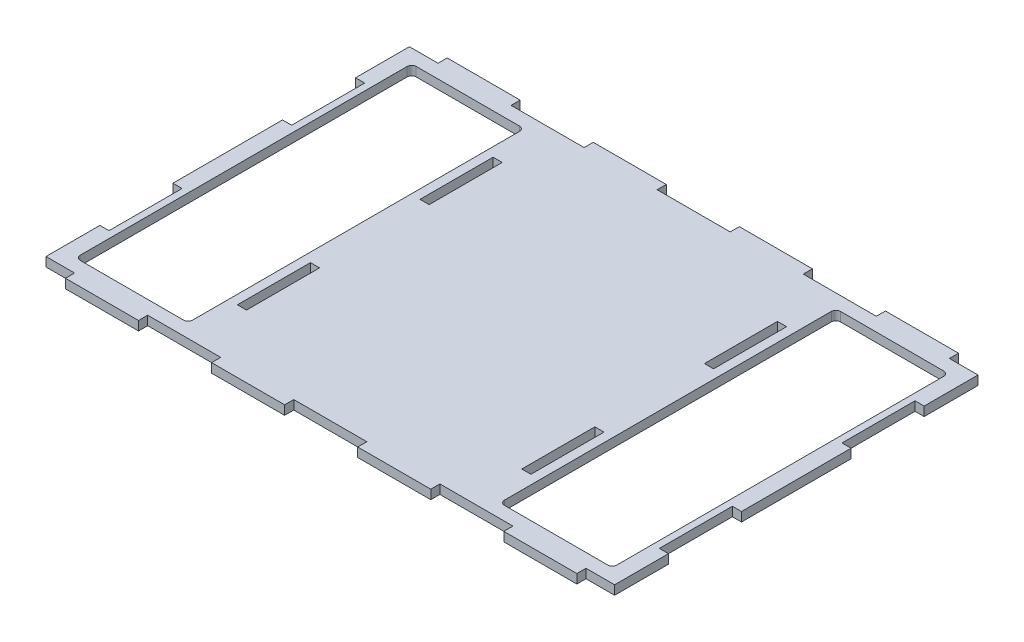
from build123d import *

# Parameters (mm, degrees)
SKETCH5_W           = 395.4
SKETCH5_H           = 265.4
BOSS_EXTRUDE3_DEPTH = 6.35
SKETCH6_W           = 78.175
SKETCH6_H           = 243.175
SKETCH6_W_2         = 75
SKETCH6_H_2         = 240
CUT_EXTRUDE1_DEPTH  = 6.35
SKETCH10_W          = 6.35
SKETCH10_H          = 50.8
SKETCH10_W_2        = 50.8
SKETCH10_H_2        = 6.35
CUT_EXTRUDE2_DEPTH  = 6.35
SKETCH11_W          = 50.8
SKETCH11_H          = 6.35
CUT_EXTRUDE3_DEPTH  = 6.35
SKETCH12_W          = 78.175
SKETCH12_H          = 4.7625
BOSS_EXTRUDE4_DEPTH = 6.35
FILLET1_R           = 3.175


with BuildPart() as part:
    # Sketch5 → Boss-Extrude3 (new body)
    with BuildSketch(Plane(origin=(0, 0, 0), x_dir=(1, 0, 0), z_dir=(0, 1, 0))):
        Rectangle(SKETCH5_W, SKETCH5_H)
    extrude(amount=BOSS_EXTRUDE3_DEPTH)

    # Sketch6 → Cut-Extrude1 (cut)
    # profile 1 of 4: a face of its own
    with BuildSketch(Plane(origin=(0, 6.35, 0), x_dir=(1, 0, 0), z_dir=(0, 1, 0))):
        with Locations((147.5, 0)):
            Rectangle(SKETCH6_W, SKETCH6_H)
        with Locations((147.5, 0)):
            Rectangle(SKETCH6_W_2, SKETCH6_H_2, mode=Mode.SUBTRACT)
    # profile 2 of 4: a face of its own
    with BuildSketch(Plane(origin=(0, 6.35, 0), x_dir=(1, 0, 0), z_dir=(0, 1, 0))):
        with Locations((147.5, 0)):
            Rectangle(SKETCH6_W_2, SKETCH6_H_2)
    # profile 3 of 4: a face of its own
    with BuildSketch(Plane(origin=(0, 6.35, 0), x_dir=(1, 0, 0), z_dir=(0, 1, 0))):
        with Locations((-147.5, 0)):
            Rectangle(SKETCH6_W, SKETCH6_H)
        with Locations((-147.5, 0)):
            Rectangle(SKETCH6_W_2, SKETCH6_H_2, mode=Mode.SUBTRACT)
    # profile 4 of 4: a face of its own
    with BuildSketch(Plane(origin=(0, 6.35, 0), x_dir=(1, 0, 0), z_dir=(0, 1, 0))):
        with Locations((-147.5, 0)):
            Rectangle(SKETCH6_W_2, SKETCH6_H_2)
    extrude(amount=-CUT_EXTRUDE1_DEPTH, mode=Mode.SUBTRACT)

    # Sketch10 → Cut-Extrude2 (cut)
    with BuildSketch(Plane.XZ):
        with Locations((98.8875, -63.5)):
            Rectangle(SKETCH10_W, SKETCH10_H)
        with Locations((98.8875, 63.5)):
            Rectangle(SKETCH10_W, SKETCH10_H)
        with Locations((-98.8875, 63.5)):
            Rectangle(SKETCH10_W, SKETCH10_H)
        with Locations((-98.8875, -63.5)):
            Rectangle(SKETCH10_W, SKETCH10_H)
        Polygon((197.7, 132.7), (177.8, 132.7), (177.8, 126.35), (191.35, 126.35), (197.7, 126.35), align=None)
        Polygon((127, 132.7), (76.2, 132.7), (76.2, 126.35), (95.7125, 126.35), (102.0625, 126.35), (108.4125, 126.35), (127, 126.35), align=None)
        with Locations((0, 129.525)):
            Rectangle(SKETCH10_W_2, SKETCH10_H_2)
        Polygon((-127, 132.7), (-127, 126.35), (-108.4125, 126.35), (-102.0625, 126.35), (-95.7125, 126.35), (-76.2, 126.35), (-76.2, 132.7), align=None)
        Polygon((-197.7, 126.35), (-191.35, 126.35), (-177.8, 126.35), (-177.8, 132.7), (-197.7, 132.7), align=None)
        Polygon((-177.8, -126.35), (-191.35, -126.35), (-197.7, -126.35), (-197.7, -132.7), (-177.8, -132.7), align=None)
        Polygon((-108.4125, -126.35), (-127, -126.35), (-127, -132.7), (-76.2, -132.7), (-76.2, -126.35), (-95.7125, -126.35), (-102.0625, -126.35), align=None)
        with Locations((0, -129.525)):
            Rectangle(SKETCH10_W_2, SKETCH10_H_2)
        Polygon((76.2, -126.35), (76.2, -132.7), (127, -132.7), (127, -126.35), (108.4125, -126.35), (102.0625, -126.35), (95.7125, -126.35), align=None)
        Polygon((177.8, -126.35), (177.8, -132.7), (197.7, -132.7), (197.7, -126.35), (191.35, -126.35), align=None)
    extrude(amount=-CUT_EXTRUDE2_DEPTH, mode=Mode.SUBTRACT)

    # Sketch11 → Cut-Extrude3 (cut)
    with BuildSketch(Plane(origin=(197.7, 0, 0), x_dir=(0, 0, -1), z_dir=(1, 0, 0))):
        with Locations((-63.5, 3.175)):
            Rectangle(SKETCH11_W, SKETCH11_H)
        with Locations((63.5, 3.175)):
            Rectangle(SKETCH11_W, SKETCH11_H)
    cut_extrude3 = extrude(amount=-CUT_EXTRUDE3_DEPTH, mode=Mode.SUBTRACT)

    # Mirror1: Cut-Extrude3 across plane
    add(cut_extrude3.mirror(Plane(origin=(0, 0, 0), x_dir=(0, 0, 1), z_dir=(1, 0, 0))), mode=Mode.SUBTRACT)

    # Sketch12 → Boss-Extrude4 (add)
    with BuildSketch(Plane.XZ):
        with Locations((147.5, -119.20625)):
            Rectangle(SKETCH12_W, SKETCH12_H)
        with Locations((147.5, 119.20625)):
            Rectangle(SKETCH12_W, SKETCH12_H)
        with Locations((-147.5, 119.20625)):
            Rectangle(SKETCH12_W, SKETCH12_H)
        with Locations((-147.5, -119.20625)):
            Rectangle(SKETCH12_W, SKETCH12_H)
    extrude(amount=-BOSS_EXTRUDE4_DEPTH)

    # Fillet1
    fillet1_edges = [part.edges().sort_by_distance(p)[0] for p in [
        (108.4125, 3.175, -116.825),
        (186.5875, 3.175, -116.825),
        (186.5875, 3.175, 116.825),
        (108.4125, 3.175, 116.825),
        (-186.5875, 3.175, 116.825),
        (-108.4125, 3.175, 116.825),
        (-108.4125, 3.175, -116.825),
        (-186.5875, 3.175, -116.825),
    ]]
    fillet(fillet1_edges, radius=FILLET1_R)


solid = part.part
